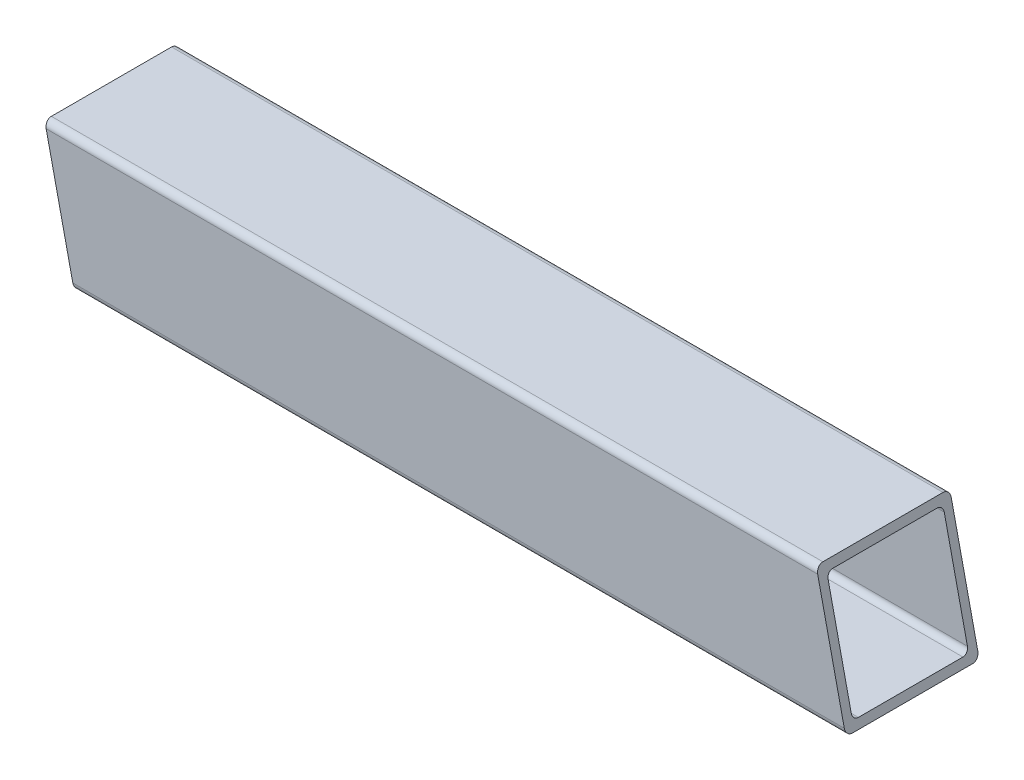
from build123d import *

# Parameters (mm, degrees)
BOSS_EXTRUDE1_DEPTH      = 76.2
BOSS_EXTRUDE1_DEPTH_BACK = 76.2
CUT_EXTRUDE1_DEPTH       = 82.319677815


with BuildPart() as part:
    # Sketch4 → Boss-Extrude1 (new, two sides: drawn at the far end of the back side and taken through both)
    with BuildSketch(Plane(origin=(0, 0, 0), x_dir=(0, 0, -1), z_dir=(1, 0, 0)).offset(-BOSS_EXTRUDE1_DEPTH_BACK)):
        with BuildLine():
            Line((12.7, -11.43), (12.7, 11.43))
            ThreePointArc((12.7, 11.43), (12.328025612, 12.328025612), (11.43, 12.7))
            Line((11.43, 12.7), (-11.43, 12.7))
            ThreePointArc((-11.43, 12.7), (-12.328025612, 12.328025612), (-12.7, 11.43))
            Line((-12.7, 11.43), (-12.7, -11.43))
            ThreePointArc((-12.7, -11.43), (-12.328025612, -12.328025612), (-11.43, -12.7))
            Line((-11.43, -12.7), (11.43, -12.7))
            ThreePointArc((11.43, -12.7), (12.328025612, -12.328025612), (12.7, -11.43))
        make_face()
        with BuildLine():
            Line((11.049, 9.9441), (11.049, -9.9441))
            ThreePointArc((11.049, -9.9441), (10.725382283, -10.725382283), (9.9441, -11.049))
            Line((9.9441, -11.049), (-9.9441, -11.049))
            ThreePointArc((-9.9441, -11.049), (-10.725382283, -10.725382283), (-11.049, -9.9441))
            Line((-11.049, -9.9441), (-11.049, 9.9441))
            ThreePointArc((-11.049, 9.9441), (-10.725382283, 10.725382283), (-9.9441, 11.049))
            Line((-9.9441, 11.049), (9.9441, 11.049))
            ThreePointArc((9.9441, 11.049), (10.725382283, 10.725382283), (11.049, 9.9441))
        make_face(mode=Mode.SUBTRACT)
    extrude(amount=BOSS_EXTRUDE1_DEPTH + BOSS_EXTRUDE1_DEPTH_BACK)

    # Sketch5 → Cut-Extrude1 (cut, through all)
    with BuildSketch(Plane.XY.offset(12.7)):
        Polygon((76.2, -12.7), (76.2, 12.7), (70.568955569, 12.7), align=None)
        Polygon((-76.2, -12.7), (-76.2, 12.7), (-70.568955569, -12.7), align=None)
    extrude(amount=-CUT_EXTRUDE1_DEPTH, mode=Mode.SUBTRACT)


solid = part.part
